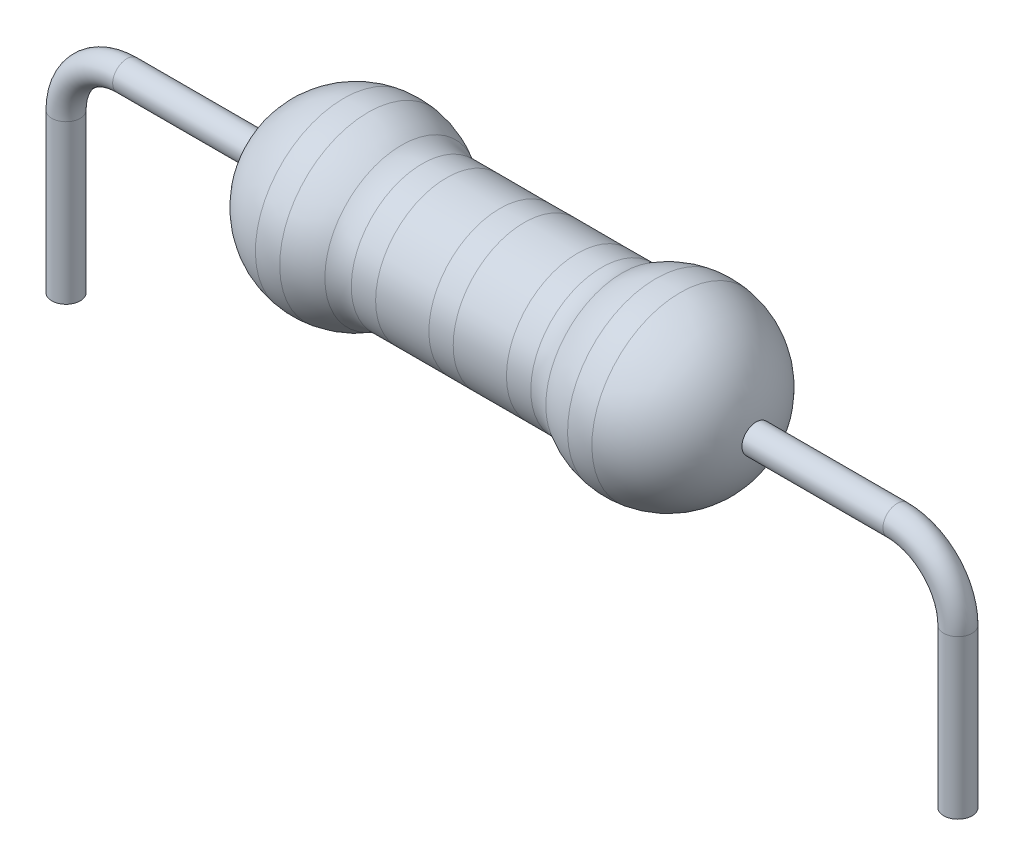
from build123d import *

# Parameters (mm, degrees)
CUT_EXTRUDE1_DEPTH      = 4.401562141
CUT_EXTRUDE1_DEPTH_BACK = 4.401562141
SKETCH4_W               = 0.028019338
SKETCH4_H               = 0.35
SKETCH9_R               = 0.175
CROQUIS1_W              = 20
CROQUIS1_H              = 20
CORTAR_EXTRUIR1_DEPTH   = 6


with BuildPart() as part:
    # Sketch1 → Revolve1 (revolve)
    with BuildSketch(Plane.XY, mode=Mode.PRIVATE) as revolve1_sk:
        with BuildLine():
            Line((-1.106846591, 0.875), (1.106846591, 0.875))
            ThreePointArc((1.106846591, 0.875), (1.239429113, 0.892898481), (1.362519532, 0.9453125))
            ThreePointArc((1.362519532, 0.9453125), (2.468723958, 0.956223958), (3.025, 0))
            Line((3.025, 0), (-3.025, 0))
            ThreePointArc((-3.025, 0), (-2.468723958, 0.956223958), (-1.362519532, 0.9453125))
            ThreePointArc((-1.362519532, 0.9453125), (-1.239429113, 0.892898481), (-1.106846591, 0.875))
        make_face()
    revolve(revolve1_sk.sketch.rotate(Axis((-3.025, 0, 0), (1, 0, 0)), 180), axis=Axis((-3.025, 0, 0), (1, 0, 0)))

    # Sketch4 → Cut-Extrude1 (cut, two sides: drawn at the far end of the back side and taken through both)
    with BuildSketch(Plane(origin=(0, 0, 0), x_dir=(1, 0, 0), z_dir=(0, 1, 0)).offset(-CUT_EXTRUDE1_DEPTH_BACK)):
        with Locations((-3.025, 0)):
            Rectangle(SKETCH4_W, SKETCH4_H)
        with Locations((3.025, 0)):
            Rectangle(SKETCH4_W, SKETCH4_H)
    extrude(amount=CUT_EXTRUDE1_DEPTH + CUT_EXTRUDE1_DEPTH_BACK, mode=Mode.SUBTRACT)


with BuildPart() as body_2:
    # Sweep4: sweep along a path in Sketch7
    with BuildLine(Plane.XY) as sweep4_path:
        Line((5.499999951, -8.7), (5.499999951, -0.75))
        ThreePointArc((5.499999951, -0.75), (5.280330037, -0.219669914), (4.749999951, 0))
        Line((4.749999951, 0), (3.010990331, 0))
        Line((3.010990331, 0), (-3.010990331, 0))
        Line((-3.010990331, 0), (-4.749999951, 0))
        ThreePointArc((-4.749999951, 0), (-5.2803301, -0.219669879), (-5.500000049, -0.75))
        Line((-5.500000049, -0.75), (-5.500000049, -8.7))
    # Sketch9 → Sweep4 (sweep)
    with BuildSketch(Plane(origin=(-5.500000049, -8.7, 0), x_dir=(1, 0, 0), z_dir=(0, 1, 0))):
        Circle(SKETCH9_R)
    sweep(path=sweep4_path.line)

    # Croquis1 → Cortar-Extruir1 (cut)
    with BuildSketch(Plane.XZ.offset(8.7)):
        Rectangle(CROQUIS1_W, CROQUIS1_H)
    extrude(amount=-CORTAR_EXTRUIR1_DEPTH, mode=Mode.SUBTRACT)


solid = Compound([part.part, body_2.part])
